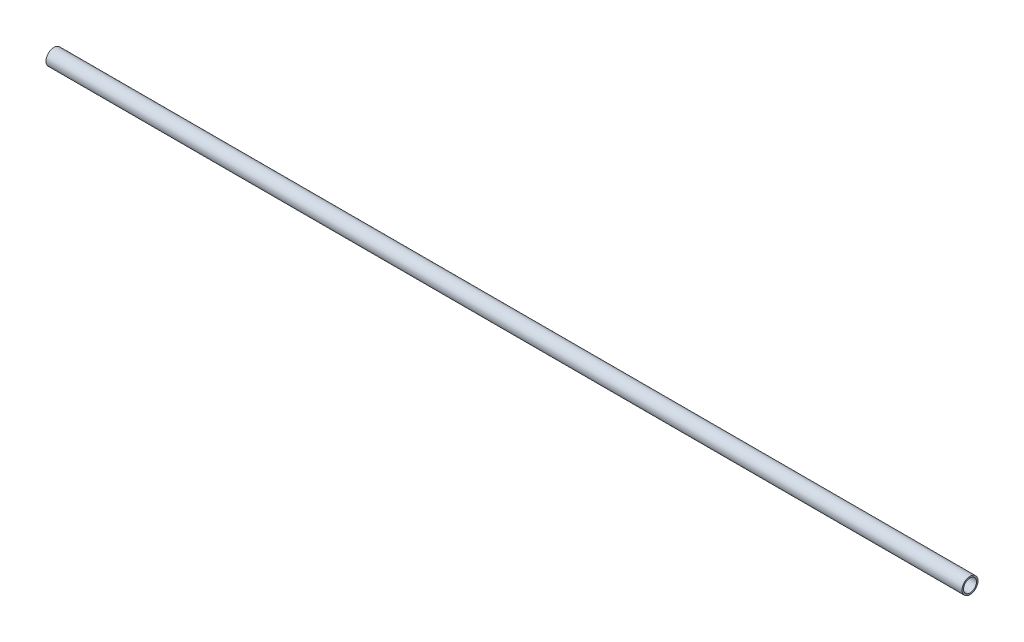
from build123d import *

# Parameters (mm, degrees)
BOSS_EXTRUDE1_DEPTH      = 215.9
BOSS_EXTRUDE1_DEPTH_BACK = 215.9
SKETCH1_R                = 3.7592
SKETCH1_R_2              = 3.048


with BuildPart() as part:
    # Sketch1 → Boss-Extrude1 (new, two sides: drawn at the far end of the back side and taken through both)
    with BuildSketch(Plane(origin=(0, 0, 0), x_dir=(0, 0, -1), z_dir=(1, 0, 0)).offset(-BOSS_EXTRUDE1_DEPTH_BACK)):
        Circle(SKETCH1_R)
        Circle(SKETCH1_R_2, mode=Mode.SUBTRACT)
    extrude(amount=BOSS_EXTRUDE1_DEPTH + BOSS_EXTRUDE1_DEPTH_BACK)


solid = part.part
